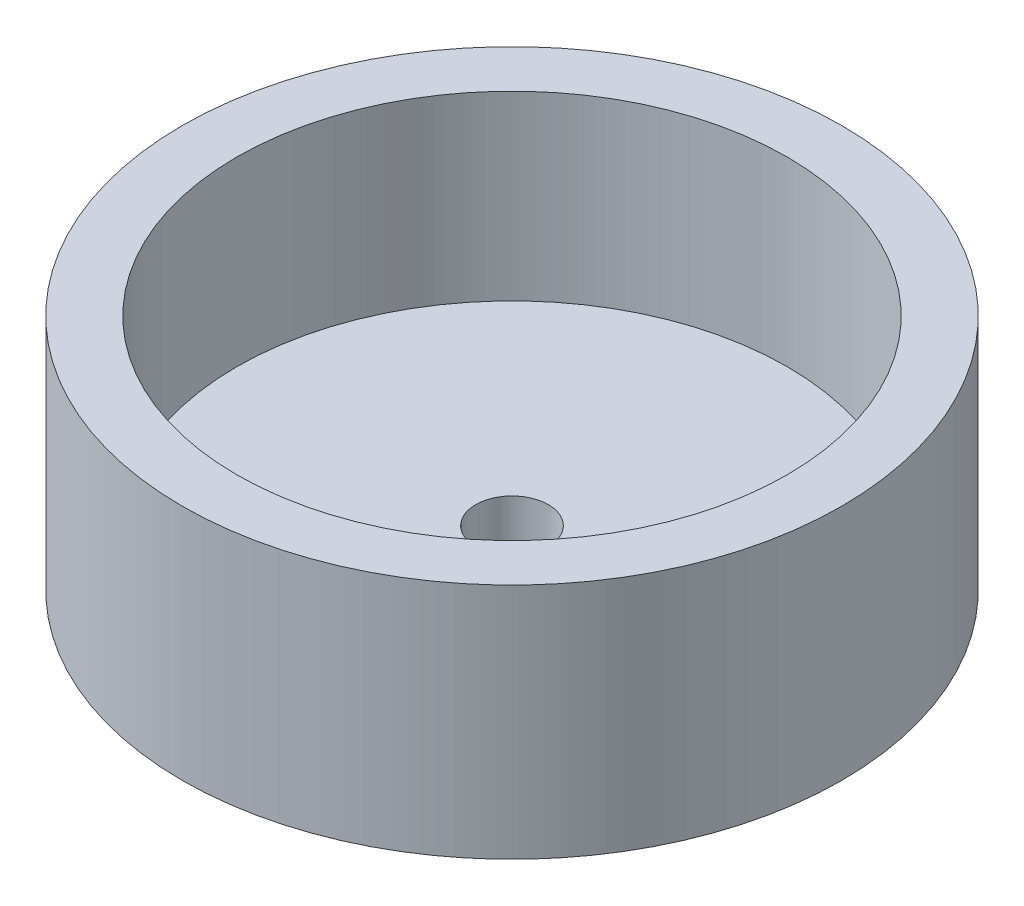
from build123d import *

# Parameters (mm, degrees)
SKETCH_1_R      = 23.6
SKETCH_1_R_2    = 19.7
SKETCH_1_R_3    = 2.6
EXTRUDE_1_DEPTH = 4
SKETCH_2_R      = 23.6
SKETCH_2_R_2    = 19.7
EXTRUDE_2_DEPTH = 13


with BuildPart() as part:
    # 草图1 → 凸台-拉伸1 (new body)
    # profile 1 of 2: a face of its own
    with BuildSketch(Plane(origin=(0, 0, 0), x_dir=(1, 0, 0), z_dir=(0, 1, 0))):
        with Locations(Location((0, 0, 0), (0, 0, 270))):
            Circle(SKETCH_1_R)
        Circle(SKETCH_1_R_2, mode=Mode.SUBTRACT)
    # profile 2 of 2: a face of its own
    with BuildSketch(Plane(origin=(0, 0, 0), x_dir=(1, 0, 0), z_dir=(0, 1, 0))):
        Circle(SKETCH_1_R_2)
        with Locations(Location((0, 0, 0), (0, 0, 270))):
            Circle(SKETCH_1_R_3, mode=Mode.SUBTRACT)
    extrude(amount=EXTRUDE_1_DEPTH)

    # 草图2 → 凸台-拉伸2 (add)
    with BuildSketch(Plane(origin=(0, 4, 0), x_dir=(1, 0, 0), z_dir=(0, 1, 0))):
        with Locations(Location((0, 0, 0), (0, 0, 270))):
            Circle(SKETCH_2_R)
        with Locations(Location((0, 0, 0), (0, 0, 90))):
            Circle(SKETCH_2_R_2, mode=Mode.SUBTRACT)
    extrude(amount=EXTRUDE_2_DEPTH)


solid = part.part
